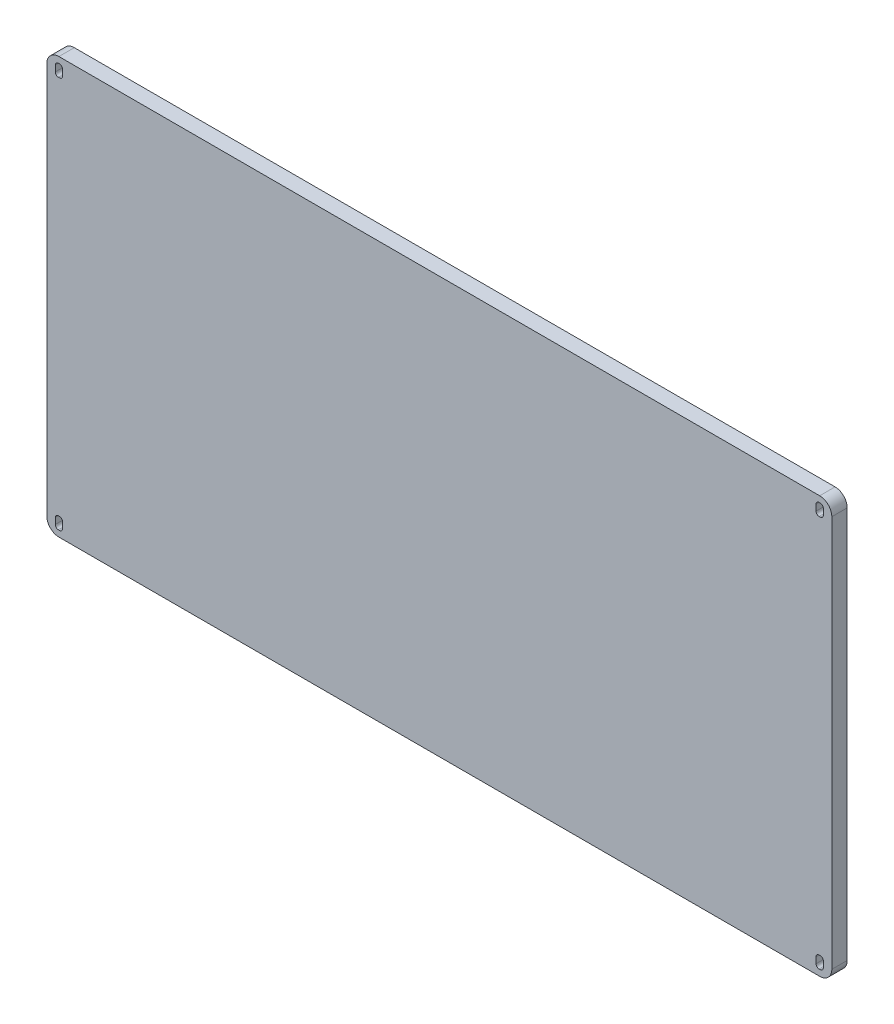
from build123d import *

# Parameters (mm, degrees)
BOSS_EXTRUDE3_DEPTH = 12.7
FILLET1_R           = 10


with BuildPart() as part:
    # Sketch1 → Boss-Extrude3 (new body)
    # profile 1 of 2: a face of its own
    with BuildSketch(Plane.XY):
        with BuildLine():
            Line((226.967032535, 244.261961814), (-410.732967465, 244.261961814))
            Line((-410.732967465, 244.261961814), (-410.732967465, 239.261961814))
            Line((-410.732967465, 239.261961814), (-410.232967465, 239.261961814))
            ThreePointArc((-410.232967465, 239.261961814), (-408.465200512, 238.529728767), (-407.732967465, 236.761961814))
            Line((-407.732967465, 236.761961814), (-407.732967465, 231.761961814))
            ThreePointArc((-407.732967465, 231.761961814), (-408.465200512, 229.994194861), (-410.232967465, 229.261961814))
            Line((-410.232967465, 229.261961814), (-410.732967465, 229.261961814))
            Line((-410.732967465, 229.261961814), (-410.732967465, -84.146038186))
            Line((-410.732967465, -84.146038186), (-410.232967465, -84.146038186))
            ThreePointArc((-410.232967465, -84.146038186), (-408.465200512, -84.878271233), (-407.732967465, -86.646038186))
            Line((-407.732967465, -86.646038186), (-407.732967465, -91.646038186))
            ThreePointArc((-407.732967465, -91.646038186), (-408.465200512, -93.413805139), (-410.232967465, -94.146038186))
            Line((-410.232967465, -94.146038186), (-410.732967465, -94.146038186))
            Line((-410.732967465, -94.146038186), (-410.732967465, -99.146038186))
            Line((-410.732967465, -99.146038186), (226.967032535, -99.146038186))
            Line((226.967032535, -99.146038186), (226.967032535, 244.261961814))
        make_face()
        with BuildLine():
            ThreePointArc((219.967032535, -91.646038186), (219.234799488, -93.413805139), (217.467032535, -94.146038186))
            Line((217.467032535, -94.146038186), (216.467032535, -94.146038186))
            ThreePointArc((216.467032535, -94.146038186), (214.699265582, -93.413805139), (213.967032535, -91.646038186))
            Line((213.967032535, -91.646038186), (213.967032535, -86.646038186))
            ThreePointArc((213.967032535, -86.646038186), (214.699265582, -84.878271233), (216.467032535, -84.146038186))
            Line((216.467032535, -84.146038186), (217.467032535, -84.146038186))
            ThreePointArc((217.467032535, -84.146038186), (219.234799488, -84.878271233), (219.967032535, -86.646038186))
            Line((219.967032535, -86.646038186), (219.967032535, -91.646038186))
        make_face(mode=Mode.SUBTRACT)
        with BuildLine():
            ThreePointArc((219.967032535, 231.761961814), (219.234799488, 229.994194861), (217.467032535, 229.261961814))
            Line((217.467032535, 229.261961814), (216.467032535, 229.261961814))
            ThreePointArc((216.467032535, 229.261961814), (214.699265582, 229.994194861), (213.967032535, 231.761961814))
            Line((213.967032535, 231.761961814), (213.967032535, 236.761961814))
            ThreePointArc((213.967032535, 236.761961814), (214.699265582, 238.529728767), (216.467032535, 239.261961814))
            Line((216.467032535, 239.261961814), (217.467032535, 239.261961814))
            ThreePointArc((217.467032535, 239.261961814), (219.234799488, 238.529728767), (219.967032535, 236.761961814))
            Line((219.967032535, 236.761961814), (219.967032535, 231.761961814))
        make_face(mode=Mode.SUBTRACT)
    # profile 2 of 2: a face of its own
    with BuildSketch(Plane.XY):
        with BuildLine():
            Line((-410.732967465, 244.261961814), (-420.732967465, 244.261961814))
            Line((-420.732967465, 244.261961814), (-420.732967465, -99.146038186))
            Line((-420.732967465, -99.146038186), (-410.732967465, -99.146038186))
            Line((-410.732967465, -99.146038186), (-410.732967465, -94.146038186))
            Line((-410.732967465, -94.146038186), (-411.232967465, -94.146038186))
            ThreePointArc((-411.232967465, -94.146038186), (-413.000734418, -93.413805139), (-413.732967465, -91.646038186))
            Line((-413.732967465, -91.646038186), (-413.732967465, -86.646038186))
            ThreePointArc((-413.732967465, -86.646038186), (-413.000734418, -84.878271233), (-411.232967465, -84.146038186))
            Line((-411.232967465, -84.146038186), (-410.732967465, -84.146038186))
            Line((-410.732967465, -84.146038186), (-410.732967465, 229.261961814))
            Line((-410.732967465, 229.261961814), (-411.232967465, 229.261961814))
            ThreePointArc((-411.232967465, 229.261961814), (-413.000734418, 229.994194861), (-413.732967465, 231.761961814))
            Line((-413.732967465, 231.761961814), (-413.732967465, 236.761961814))
            ThreePointArc((-413.732967465, 236.761961814), (-413.000734418, 238.529728767), (-411.232967465, 239.261961814))
            Line((-411.232967465, 239.261961814), (-410.732967465, 239.261961814))
            Line((-410.732967465, 239.261961814), (-410.732967465, 244.261961814))
        make_face()
    extrude(amount=BOSS_EXTRUDE3_DEPTH)

    # Fillet1
    fillet1_edges = [part.edges().sort_by_distance(p)[0] for p in [
        (-420.732967465, 244.261961814, 6.35),
        (226.967032535, 244.261961814, 6.35),
        (226.967032535, -99.146038186, 6.35),
        (-420.732967465, -99.146038186, 6.35),
    ]]
    fillet(fillet1_edges, radius=FILLET1_R)


solid = part.part
